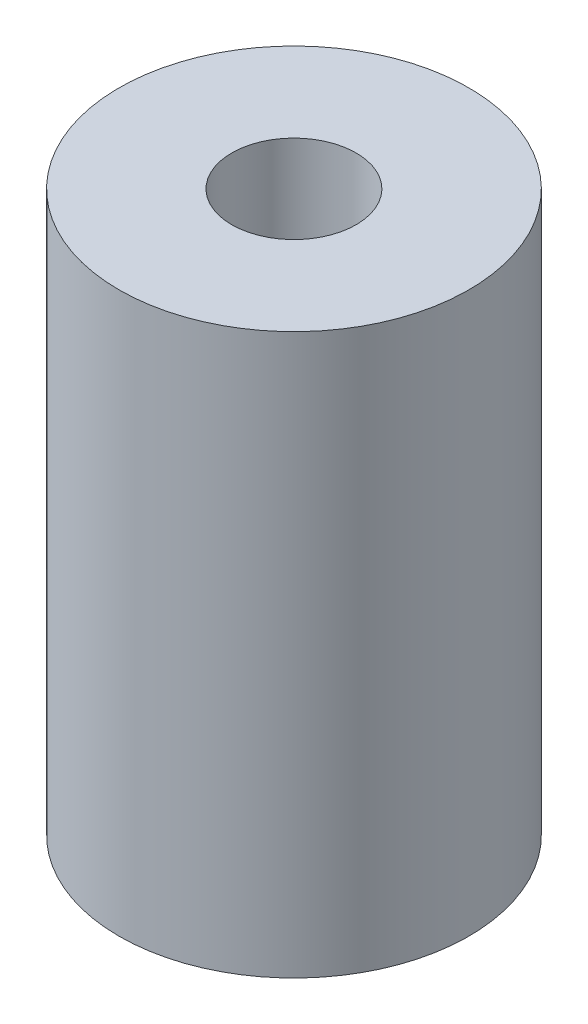
from build123d import *

# Parameters (mm, degrees)
SKETCH1_R           = 4.5
SKETCH1_R_2         = 1.6
BOSS_EXTRUDE1_DEPTH = 14.4


with BuildPart() as part:
    # Sketch1 → Boss-Extrude1 (new body)
    with BuildSketch(Plane(origin=(0, 0, 0), x_dir=(1, 0, 0), z_dir=(0, 1, 0))):
        with Locations(Location((0, 0, 0), (0, 0, 270))):
            Circle(SKETCH1_R)
        with Locations(Location((0, 0, 0), (0, 0, 270))):
            Circle(SKETCH1_R_2, mode=Mode.SUBTRACT)
    extrude(amount=BOSS_EXTRUDE1_DEPTH)


solid = part.part
